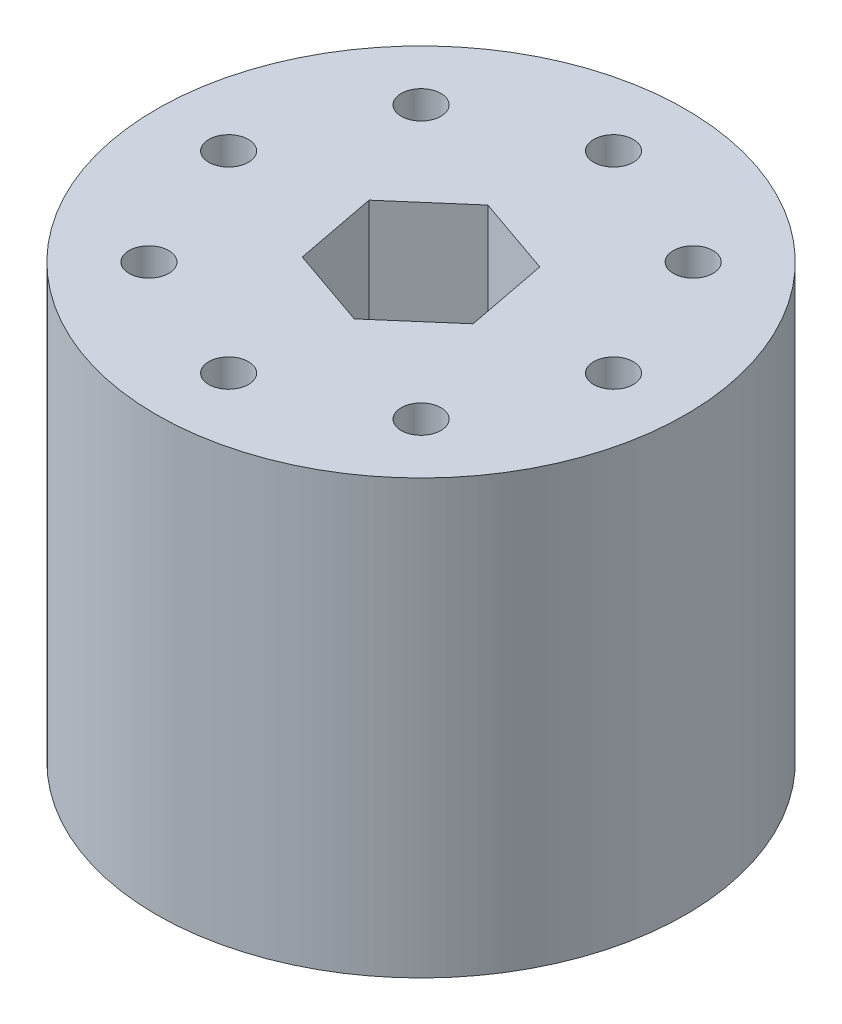
from build123d import *

# Parameters (mm, degrees)
SKETCH1_R               = 22
BOSS_EXTRUDE1_DEPTH     = 36
CUT_EXTRUDE1_DEPTH      = 48.581509013
CUT_EXTRUDE1_DEPTH_BACK = 48.581509013
SKETCH2_R               = 1.65
CUT_EXTRUDE2_DEPTH      = 10
SKETCH4_R               = 2.3
CUT_EXTRUDE3_DEPTH      = 38
SKETCH5_R               = 5.59540043
CUT_EXTRUDE4_DEPTH      = 9


with BuildPart() as part:
    # Sketch1 → Boss-Extrude1 (new body)
    with BuildSketch(Plane(origin=(0, 0, 0), x_dir=(1, 0, 0), z_dir=(0, 1, 0))):
        with Locations(Location((0, 0, 0), (0, 0, 270))):
            Circle(SKETCH1_R)
    extrude(amount=BOSS_EXTRUDE1_DEPTH)

    # Sketch2 → Cut-Extrude1 (cut, two sides: drawn at the far end of the back side and taken through both)
    with BuildSketch(Plane(origin=(0, 36, 0), x_dir=(1, 0, 0), z_dir=(0, 1, 0)).offset(-CUT_EXTRUDE1_DEPTH_BACK)):
        with Locations(Location((-11.313708499, 11.313708499, 0), (0, 0, 270))):
            Circle(SKETCH2_R)
        with Locations(Location((0, 16, 0), (0, 0, 270))):
            Circle(SKETCH2_R)
        with Locations(Location((16, 0, 0), (0, 0, 270))):
            Circle(SKETCH2_R)
        with Locations(Location((11.313708499, 11.313708499, 0), (0, 0, 270))):
            Circle(SKETCH2_R)
        with Locations(Location((0, -16, 0), (0, 0, 270))):
            Circle(SKETCH2_R)
        with Locations(Location((11.313708499, -11.313708499, 0), (0, 0, 270))):
            Circle(SKETCH2_R)
        with Locations(Location((-16, 0, 0), (0, 0, 270))):
            Circle(SKETCH2_R)
        with Locations(Location((-11.313708499, -11.313708499, 0), (0, 0, 270))):
            Circle(SKETCH2_R)
    extrude(amount=CUT_EXTRUDE1_DEPTH + CUT_EXTRUDE1_DEPTH_BACK, mode=Mode.SUBTRACT)

    # Sketch3 → Cut-Extrude2 (cut)
    with BuildSketch(Plane(origin=(0, 36, 0), x_dir=(1, 0, 0), z_dir=(0, 1, 0))):
        Polygon((1.321693068, -6.874091026), (6.613983991, -2.29242574), (5.292290922, 4.581665286), (-1.321693068, 6.874091026), (-6.613983991, 2.29242574), (-5.292290922, -4.581665286), align=None)
    extrude(amount=-CUT_EXTRUDE2_DEPTH, mode=Mode.SUBTRACT)

    # Sketch4 → Cut-Extrude3 (cut)
    with BuildSketch(Plane(origin=(0, 26, 0), x_dir=(1, 0, 0), z_dir=(0, 1, 0))):
        with Locations(Location((0, 0, 0), (0, 0, 270))):
            Circle(SKETCH4_R)
    extrude(amount=-CUT_EXTRUDE3_DEPTH, mode=Mode.SUBTRACT)

    # Sketch5 → Cut-Extrude4 (cut)
    with BuildSketch(Plane(origin=(0, 0, 0), x_dir=(-1, 0, 0), z_dir=(0, -1, 0))):
        with Locations(Location((0, 0, 0), (0, 0, 90))):
            Circle(SKETCH5_R)
    extrude(amount=-CUT_EXTRUDE4_DEPTH, mode=Mode.SUBTRACT)


solid = part.part
